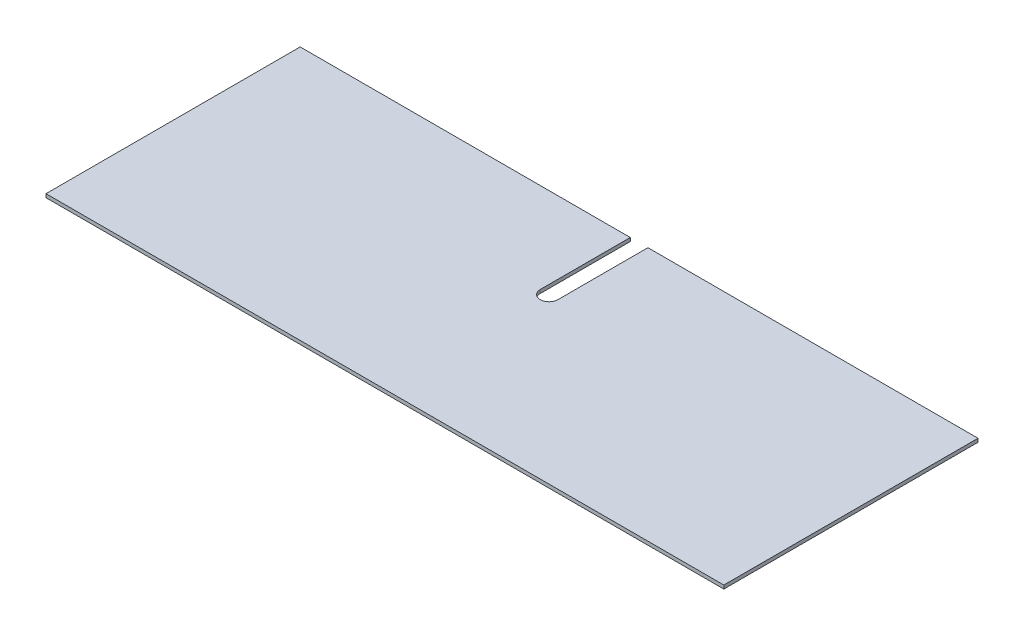
from build123d import *

# Parameters (mm, degrees)
SKETCH1_W           = 609.6
SKETCH1_H           = 228.6
BOSS_EXTRUDE1_DEPTH = 3.175
CUT_EXTRUDE1_DEPTH  = 652.060827131


with BuildPart() as part:
    # Sketch1 → Boss-Extrude1 (new body)
    with BuildSketch(Plane(origin=(0, 0, 0), x_dir=(1, 0, 0), z_dir=(0, 1, 0))):
        with Locations((304.8, 114.3)):
            Rectangle(SKETCH1_W, SKETCH1_H)
    extrude(amount=BOSS_EXTRUDE1_DEPTH)

    # Sketch2 → Cut-Extrude1 (cut, through all)
    with BuildSketch(Plane(origin=(0, 3.175, 0), x_dir=(1, 0, 0), z_dir=(0, 1, 0))):
        with BuildLine():
            Line((296.8625, 228.6), (312.7375, 228.6))
            Line((312.7375, 228.6), (312.7375, 147.6375))
            ThreePointArc((312.7375, 147.6375), (304.8, 139.7), (296.8625, 147.6375))
            Line((296.8625, 147.6375), (296.8625, 228.6))
        make_face()
    extrude(amount=-CUT_EXTRUDE1_DEPTH, mode=Mode.SUBTRACT)


solid = part.part
